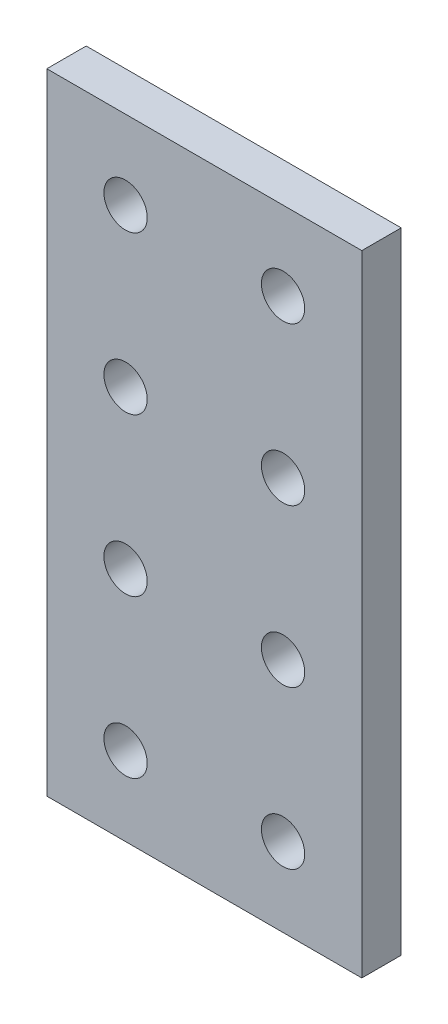
from build123d import *

# Parameters (mm, degrees)
ESQUISSE1_W        = 40
ESQUISSE1_H        = 80
ESQUISSE1_R        = 2.75
BOSS_EXTRU_1_DEPTH = 5


with BuildPart() as part:
    # Esquisse1 → Boss.-Extru.1 (new body)
    with BuildSketch(Plane.XY):
        with Locations((-40.349893162, -20.555555556)):
            Rectangle(ESQUISSE1_W, ESQUISSE1_H)
        with Locations((-50.349893162, 9.444444444)):
            Circle(ESQUISSE1_R, mode=Mode.SUBTRACT)
        with Locations((-30.349893162, 9.444444444)):
            Circle(ESQUISSE1_R, mode=Mode.SUBTRACT)
        with Locations((-30.349893162, -10.555555556)):
            Circle(ESQUISSE1_R, mode=Mode.SUBTRACT)
        with Locations((-30.349893162, -30.555555556)):
            Circle(ESQUISSE1_R, mode=Mode.SUBTRACT)
        with Locations((-30.349893162, -50.555555556)):
            Circle(ESQUISSE1_R, mode=Mode.SUBTRACT)
        with Locations((-50.349893162, -10.555555556)):
            Circle(ESQUISSE1_R, mode=Mode.SUBTRACT)
        with Locations((-50.349893162, -30.555555556)):
            Circle(ESQUISSE1_R, mode=Mode.SUBTRACT)
        with Locations((-50.349893162, -50.555555556)):
            Circle(ESQUISSE1_R, mode=Mode.SUBTRACT)
    extrude(amount=BOSS_EXTRU_1_DEPTH)


solid = part.part
